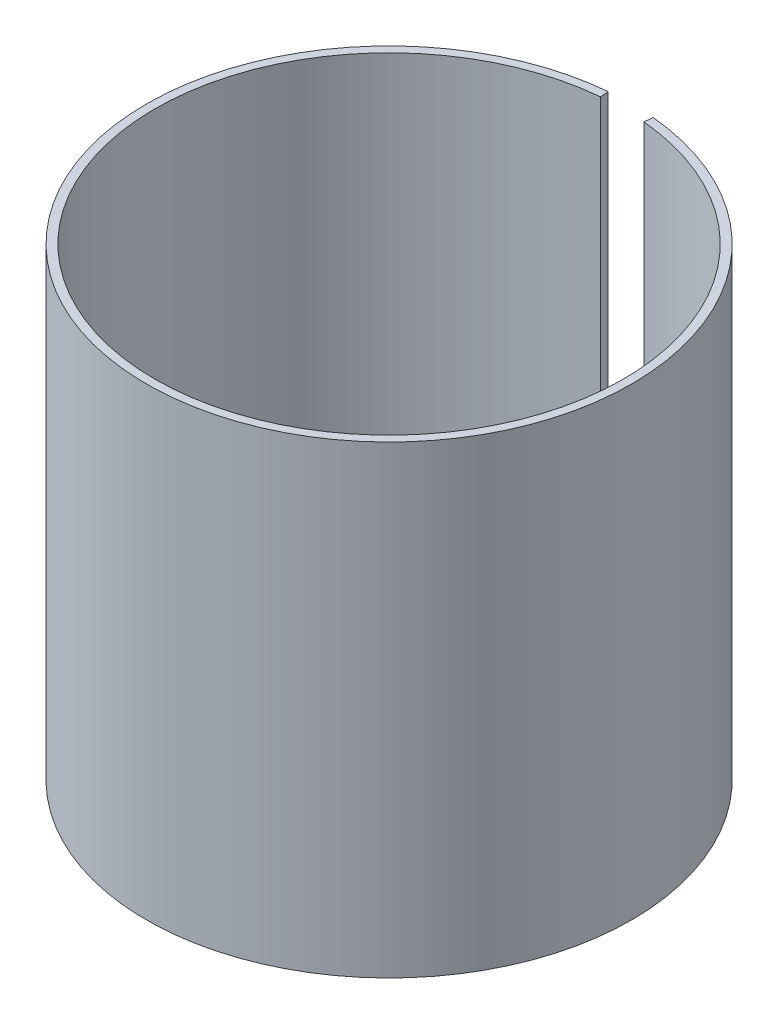
from build123d import *

# Parameters (mm, degrees)
SKETCH_1_R               = 86.5
SKETCH_1_R_2             = 83.5
EXTRUDE_1_DEPTH          = 165.5
CUT_EXTRUDE_1_DEPTH      = 206.802696775
CUT_EXTRUDE_1_DEPTH_BACK = 206.802696775


with BuildPart() as part:
    # Эскиз1 → Бобышка-Вытянуть1 (new body)
    with BuildSketch(Plane(origin=(0, 0, 0), x_dir=(1, 0, 0), z_dir=(0, 1, 0))):
        with Locations(Location((0, 0, 0), (0, 0, 270))):
            Circle(SKETCH_1_R)
        with Locations(Location((0, 0, 0), (0, 0, 270))):
            Circle(SKETCH_1_R_2, mode=Mode.SUBTRACT)
    extrude(amount=EXTRUDE_1_DEPTH)

    # Эскиз2 → Вырез-Вытянуть1 (cut, two sides: drawn at the far end of the back side and taken through both)
    with BuildSketch(Plane(origin=(0, 165.5, 0), x_dir=(1, 0, 0), z_dir=(0, 1, 0)).offset(-CUT_EXTRUDE_1_DEPTH_BACK)):
        with BuildLine():
            Line((-8, 86.12926332), (-7.722543353, 83.142121239))
            ThreePointArc((-7.722543353, 83.142121239), (0, 83.5), (7.722543353, 83.142121239))
            Line((7.722543353, 83.142121239), (8, 86.12926332))
            ThreePointArc((8, 86.12926332), (0, 86.5), (-8, 86.12926332))
        make_face()
    extrude(amount=CUT_EXTRUDE_1_DEPTH + CUT_EXTRUDE_1_DEPTH_BACK, mode=Mode.SUBTRACT)


solid = part.part
